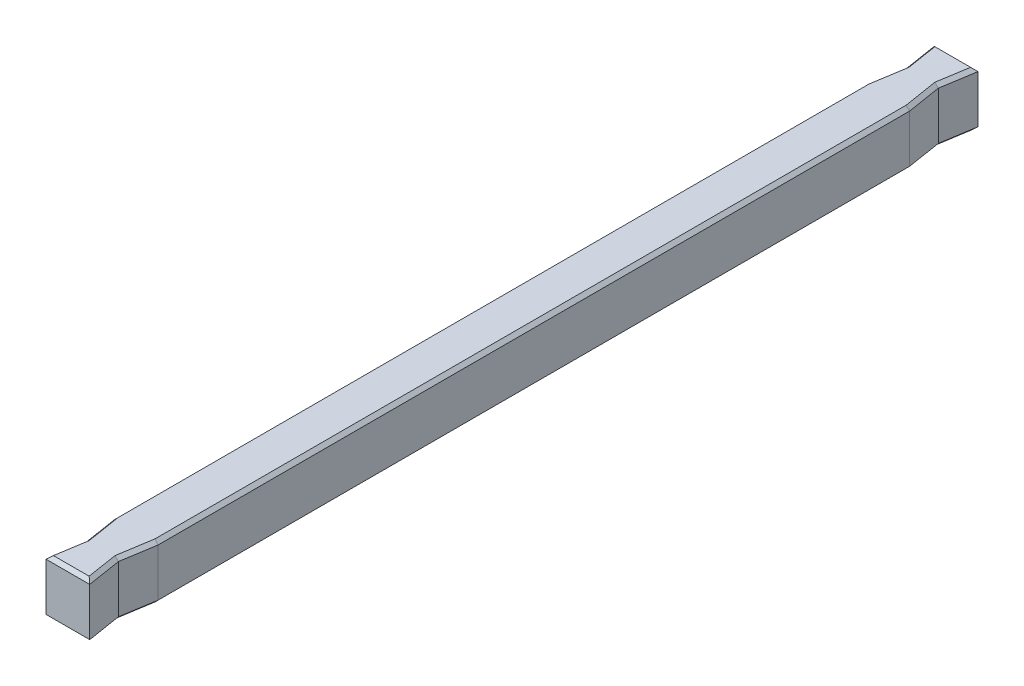
from build123d import *

# Parameters (mm, degrees)
BOSS_EXTRUDE1_DEPTH = 4
CHAMFER1_SIZE       = 0.25


with BuildPart() as part:
    # Sketch1 → Boss-Extrude1 (new body)
    with BuildSketch(Plane(origin=(0, 0, 0), x_dir=(1, 0, 0), z_dir=(0, 1, 0))):
        Polygon((-1.6, 0), (1.6, 0), (1.2, 2.5), (1.6, 5), (1.6, 60), (1.2, 62.5), (1.6, 65), (-1.6, 65), (-1.2, 62.5), (-1.6, 60), (-1.6, 5), (-1.2, 2.5), align=None)
    extrude(amount=BOSS_EXTRUDE1_DEPTH)

    # Chamfer1
    chamfer1_edges = [part.edges().sort_by_distance(p)[0] for p in [
        (-1.4, 0, -3.75),
        (-1.6, 0, -32.5),
        (1.4, 4, -1.25),
        (-1.4, 0, -61.25),
        (-1.4, 0, -63.75),
        (0, 0, -65),
        (1.4, 0, -63.75),
        (1.4, 0, -61.25),
        (1.6, 0, -32.5),
        (1.4, 0, -3.75),
        (1.4, 0, -1.25),
        (0, 0, 0),
        (-1.4, 0, -1.25),
        (1.4, 4, -3.75),
        (1.6, 4, -32.5),
        (1.4, 4, -61.25),
        (1.4, 4, -63.75),
        (0, 4, -65),
        (-1.4, 4, -63.75),
        (-1.4, 4, -61.25),
        (-1.6, 4, -32.5),
        (-1.4, 4, -3.75),
        (-1.4, 4, -1.25),
        (0, 4, 0),
    ]]
    chamfer(chamfer1_edges, length=CHAMFER1_SIZE)


solid = part.part
